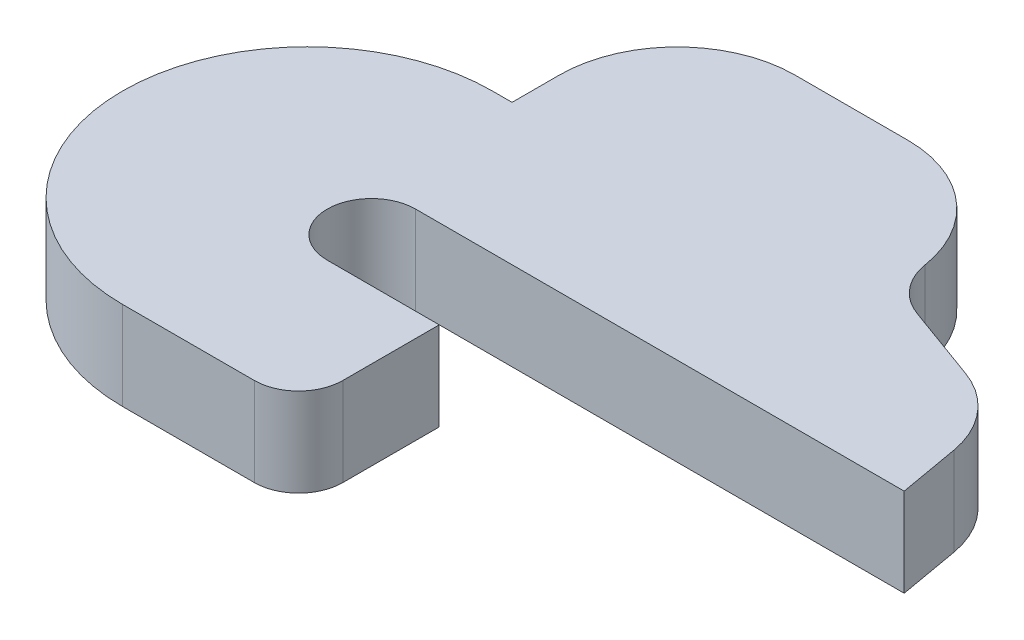
from build123d import *

# Parameters (mm, degrees)
BOSS_EXTRUDE2_DEPTH = 3


with BuildPart() as part:
    # Sketch1 → Boss-Extrude2 (new body)
    with BuildSketch(Plane(origin=(0, 0, 0), x_dir=(1, 0, 0), z_dir=(0, 1, 0))):
        with BuildLine():
            Line((0, 0), (-3.8, 0))
            ThreePointArc((-3.8, 0), (-5.3, 1.5), (-3.8, 3))
            Line((-3.8, 3), (12.77, 3))
            Line((12.77, 3), (12.408822115, 5.04834157))
            ThreePointArc((12.408822115, 5.04834157), (11.708482238, 6.549941992), (10.351032589, 7.5))
            Line((10.351032589, 7.5), (7.77, 8.438574292))
            ThreePointArc((7.77, 8.438574292), (6.911457646, 9.044534587), (6.478627211, 10.002104777))
            ThreePointArc((6.478627211, 10.002104777), (5.12422767, 12.413716405), (2.52888753, 13.37))
            Line((2.52888753, 13.37), (-1.3, 13.37))
            ThreePointArc((-1.3, 13.37), (-4.128427125, 12.198427125), (-5.3, 9.37))
            Line((-5.3, 9.37), (-5.3, 7.77))
            Line((-5.3, 7.77), (-5.97, 7.77))
            ThreePointArc((-5.97, 7.77), (-12.24, 1.5), (-5.97, -4.77))
            Line((-5.97, -4.77), (-1.5, -4.77))
            ThreePointArc((-1.5, -4.77), (-0.439339828, -4.330660172), (0, -3.27))
            Line((0, -3.27), (0, 0))
        make_face()
    extrude(amount=BOSS_EXTRUDE2_DEPTH)


solid = part.part
